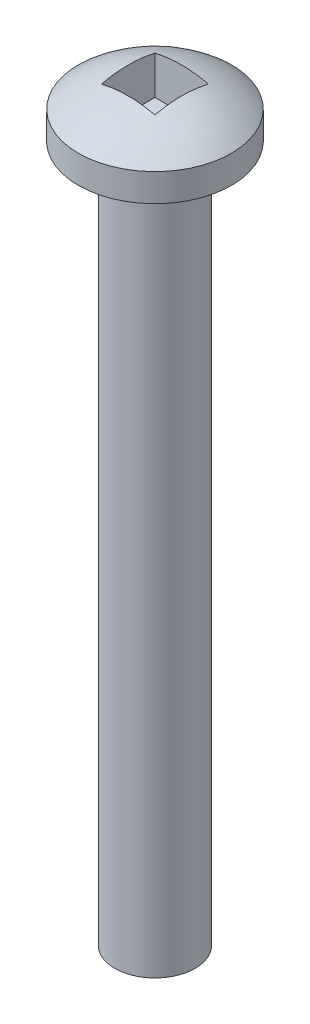
from build123d import *

# Parameters (mm, degrees)
SKETCH1_R           = 1.8288
BOSS_EXTRUDE1_DEPTH = 31.75
SKETCH2_R           = 3.4925
BOSS_EXTRUDE2_DEPTH = 1.27
DOME1_FACE_RADIUS   = 3.4925
DOME1_HEIGHT        = 1.27
SKETCH3_W           = 2.4384
SKETCH3_H           = 2.4384
CUT_EXTRUDE1_DEPTH  = 2.032


with BuildPart() as part:
    # Sketch1 → Boss-Extrude1 (new body)
    with BuildSketch(Plane(origin=(0, 0, 0), x_dir=(1, 0, 0), z_dir=(0, 1, 0))):
        with Locations(Location((0, 0, 0), (0, 0, 270))):
            Circle(SKETCH1_R)
    extrude(amount=-BOSS_EXTRUDE1_DEPTH)

    # Sketch2 → Boss-Extrude2 (add)
    with BuildSketch(Plane(origin=(0, 0, 0), x_dir=(1, 0, 0), z_dir=(0, 1, 0))):
        with Locations(Location((0, 0, 0), (0, 0, 270))):
            Circle(SKETCH2_R)
    extrude(amount=BOSS_EXTRUDE2_DEPTH)

    # Dome1: a dome of height H over a round flat face of radius A is a cap of a sphere of radius (A * A + H * H) / (2 * H)
    dome1_r = (DOME1_FACE_RADIUS * DOME1_FACE_RADIUS + DOME1_HEIGHT * DOME1_HEIGHT) / (2 * DOME1_HEIGHT)
    dome1_base = Plane((0, 1.27, 0), z_dir=(0, 1, 0))
    with Locations(dome1_base.offset(DOME1_HEIGHT - dome1_r)):
        dome1_ball = Sphere(dome1_r, mode=Mode.PRIVATE)
    add(split(dome1_ball, bisect_by=dome1_base, keep=Keep.TOP, mode=Mode.PRIVATE))

    # Sketch3 → Cut-Extrude1 (cut)
    with BuildSketch(Plane(origin=(0, 2.54, 0), x_dir=(1, 0, 0), z_dir=(0, 1, 0))):
        Rectangle(SKETCH3_W, SKETCH3_H)
    extrude(amount=-CUT_EXTRUDE1_DEPTH, mode=Mode.SUBTRACT)


solid = part.part
